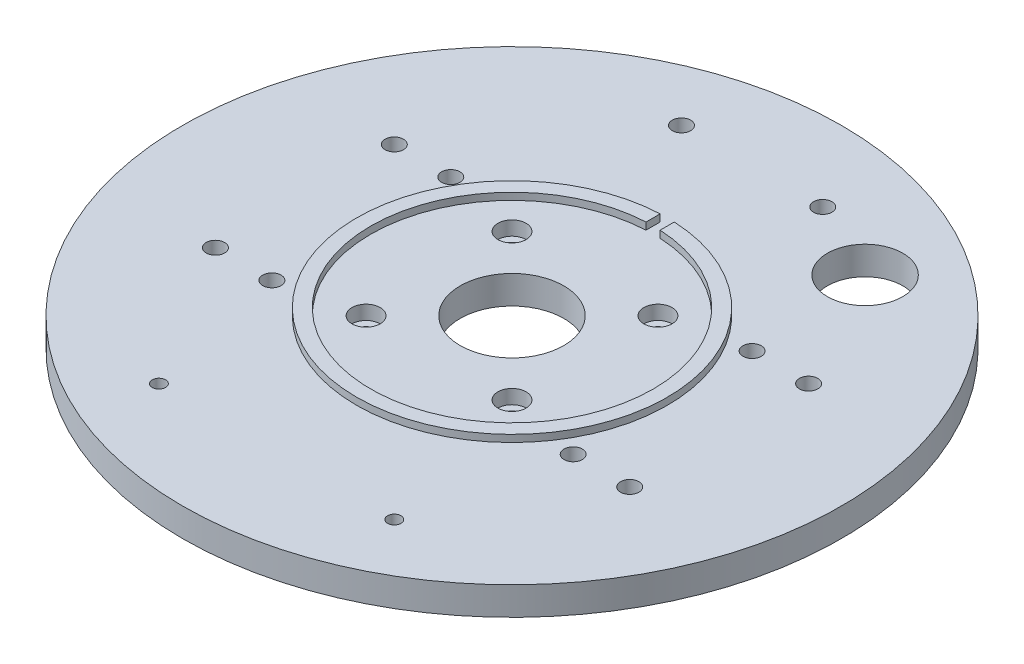
from build123d import *

# Parameters (mm, degrees)
SKETCH1_R           = 70
SKETCH1_R_2         = 11
BOSS_EXTRUDE1_DEPTH = 6
SKETCH2_R           = 1.42
CUT_EXTRUDE2_DEPTH  = 10
SKETCH4_R           = 3
CUT_EXTRUDE3_DEPTH  = 3
SKETCH5_R           = 1.95
CUT_EXTRUDE4_DEPTH  = 10
SKETCH6_R           = 1.95
CUT_EXTRUDE5_DEPTH  = 6
SKETCH7_R           = 1.42
CUT_EXTRUDE6_DEPTH  = 10
SKETCH8_R           = 8
CUT_EXTRUDE7_DEPTH  = 10
SKETCH9_R           = 33
SKETCH9_R_2         = 30
BOSS_EXTRUDE2_DEPTH = 1.5
SKETCH10_W          = 3
SKETCH10_H          = 10.861840942
CUT_EXTRUDE9_DEPTH  = 1.5
SKETCH11_R          = 2.471165228
BOSS_EXTRUDE3_DEPTH = 1


with BuildPart() as part:
    # Sketch1 → Boss-Extrude1 (new body)
    with BuildSketch(Plane(origin=(0, 0, 0), x_dir=(1, 0, 0), z_dir=(0, 1, 0))):
        with Locations(Location((0, 0, 0), (0, 0, 270))):
            Circle(SKETCH1_R)
        with Locations(Location((0, 0, 0), (0, 0, 270))):
            Circle(SKETCH1_R_2, mode=Mode.SUBTRACT)
    extrude(amount=BOSS_EXTRUDE1_DEPTH)

    # Sketch2 → Cut-Extrude2 (cut)
    with BuildSketch(Plane(origin=(0, 6, 0), x_dir=(1, 0, 0), z_dir=(0, 1, 0))):
        with Locations(Location((-15.5, 15.5, 0), (0, 0, 270))):
            Circle(SKETCH2_R)
        with Locations(Location((15.5, 15.5, 0), (0, 0, 270))):
            Circle(SKETCH2_R)
        with Locations(Location((15.5, -15.5, 0), (0, 0, 270))):
            Circle(SKETCH2_R)
        with Locations(Location((-15.5, -15.5, 0), (0, 0, 270))):
            Circle(SKETCH2_R)
    extrude(amount=-CUT_EXTRUDE2_DEPTH, mode=Mode.SUBTRACT)

    # Sketch4 → Cut-Extrude3 (cut)
    with BuildSketch(Plane(origin=(0, 6, 0), x_dir=(1, 0, 0), z_dir=(0, 1, 0))):
        with Locations(Location((-15.5, 15.5, 0), (0, 0, 270))):
            Circle(SKETCH4_R)
        with Locations(Location((15.5, 15.5, 0), (0, 0, 270))):
            Circle(SKETCH4_R)
        with Locations(Location((15.5, -15.5, 0), (0, 0, 270))):
            Circle(SKETCH4_R)
        with Locations(Location((-15.5, -15.5, 0), (0, 0, 270))):
            Circle(SKETCH4_R)
    extrude(amount=-CUT_EXTRUDE3_DEPTH, mode=Mode.SUBTRACT)

    # Sketch5 → Cut-Extrude4 (cut)
    with BuildSketch(Plane(origin=(0, 6, 0), x_dir=(1, 0, 0), z_dir=(0, 1, 0))):
        with Locations(Location((-32, 19, 0), (0, 0, 270))):
            Circle(SKETCH5_R)
        with Locations(Location((-44, 19, 0), (0, 0, 270))):
            Circle(SKETCH5_R)
        with Locations(Location((-44, -19, 0), (0, 0, 270))):
            Circle(SKETCH5_R)
        with Locations(Location((-32, -19, 0), (0, 0, 270))):
            Circle(SKETCH5_R)
        with Locations(Location((32, -19, 0), (0, 0, 270))):
            Circle(SKETCH5_R)
        with Locations(Location((44, -19, 0), (0, 0, 270))):
            Circle(SKETCH5_R)
        with Locations(Location((44, 19, 0), (0, 0, 270))):
            Circle(SKETCH5_R)
        with Locations(Location((32, 19, 0), (0, 0, 270))):
            Circle(SKETCH5_R)
    extrude(amount=-CUT_EXTRUDE4_DEPTH, mode=Mode.SUBTRACT)

    # Sketch6 → Cut-Extrude5 (cut)
    with BuildSketch(Plane(origin=(0, 6, 0), x_dir=(1, 0, 0), z_dir=(0, 1, 0))):
        with Locations(Location((13, 29, 0), (0, 0, 270))):
            Circle(SKETCH6_R)
        with Locations(Location((13, 53, 0), (0, 0, 270))):
            Circle(SKETCH6_R)
        with Locations(Location((-17, 52.999810288, 0), (0, 0, 270))):
            Circle(SKETCH6_R)
    extrude(amount=-CUT_EXTRUDE5_DEPTH, mode=Mode.SUBTRACT)

    # Sketch7 → Cut-Extrude6 (cut)
    with BuildSketch(Plane(origin=(0, 6, 0), x_dir=(1, 0, 0), z_dir=(0, 1, 0))):
        with Locations(Location((-25, -50, 0), (0, 0, 270))):
            Circle(SKETCH7_R)
        with Locations(Location((25, -50, 0), (0, 0, 270))):
            Circle(SKETCH7_R)
    extrude(amount=-CUT_EXTRUDE6_DEPTH, mode=Mode.SUBTRACT)

    # Sketch8 → Cut-Extrude7 (cut)
    with BuildSketch(Plane(origin=(0, 6, 0), x_dir=(1, 0, 0), z_dir=(0, 1, 0))):
        with Locations(Location((30, 45, 0), (0, 0, 270))):
            Circle(SKETCH8_R)
    extrude(amount=-CUT_EXTRUDE7_DEPTH, mode=Mode.SUBTRACT)

    # Sketch9 → Boss-Extrude2 (add)
    with BuildSketch(Plane(origin=(0, 6, 0), x_dir=(1, 0, 0), z_dir=(0, 1, 0))):
        with Locations(Location((0, 0, 0), (0, 0, 68.546799355))):
            Circle(SKETCH9_R)
        with Locations(Location((0, 0, 0), (0, 0, 67.330047366))):
            Circle(SKETCH9_R_2, mode=Mode.SUBTRACT)
    extrude(amount=BOSS_EXTRUDE2_DEPTH)

    # Sketch10 → Cut-Extrude9 (cut)
    with BuildSketch(Plane(origin=(0, 7.5, 0), x_dir=(1, 0, 0), z_dir=(0, 1, 0))):
        with Locations((0, 31.635111745)):
            Rectangle(SKETCH10_W, SKETCH10_H)
    extrude(amount=-CUT_EXTRUDE9_DEPTH, mode=Mode.SUBTRACT)

    # Sketch11 → Boss-Extrude3 (add)
    with BuildSketch(Plane(origin=(0, 6, 0), x_dir=(1, 0, 0), z_dir=(0, 1, 0))):
        with Locations((13, 29)):
            Circle(SKETCH11_R)
    extrude(amount=-BOSS_EXTRUDE3_DEPTH)


solid = part.part
